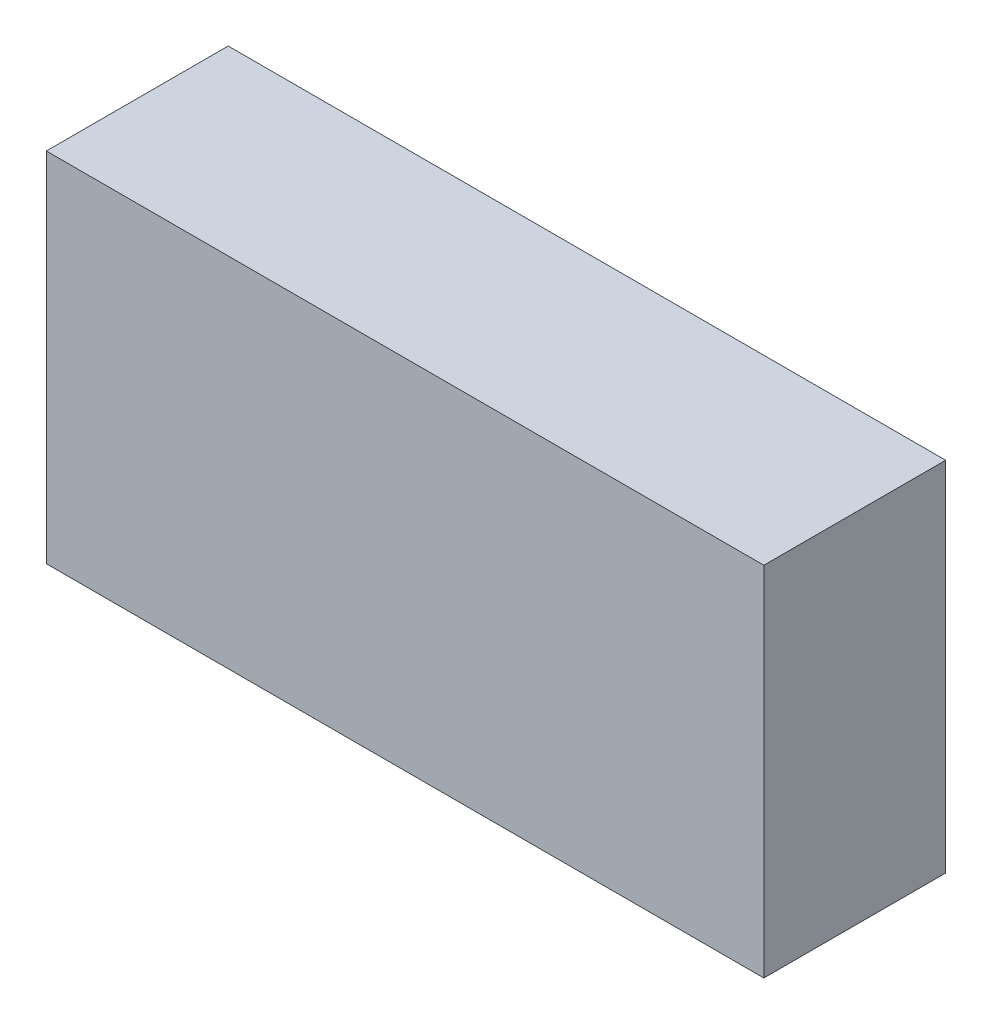
from build123d import *

# Parameters (mm, degrees)
SKETCH1_W               = 3.946
SKETCH1_H               = 1.966
COMPONENT_OUTLINE_DEPTH = 1


with BuildPart() as part:
    # Sketch1 → Component_Outline (new body)
    with BuildSketch(Plane.XY):
        Rectangle(SKETCH1_W, SKETCH1_H)
    extrude(amount=COMPONENT_OUTLINE_DEPTH)


solid = part.part
